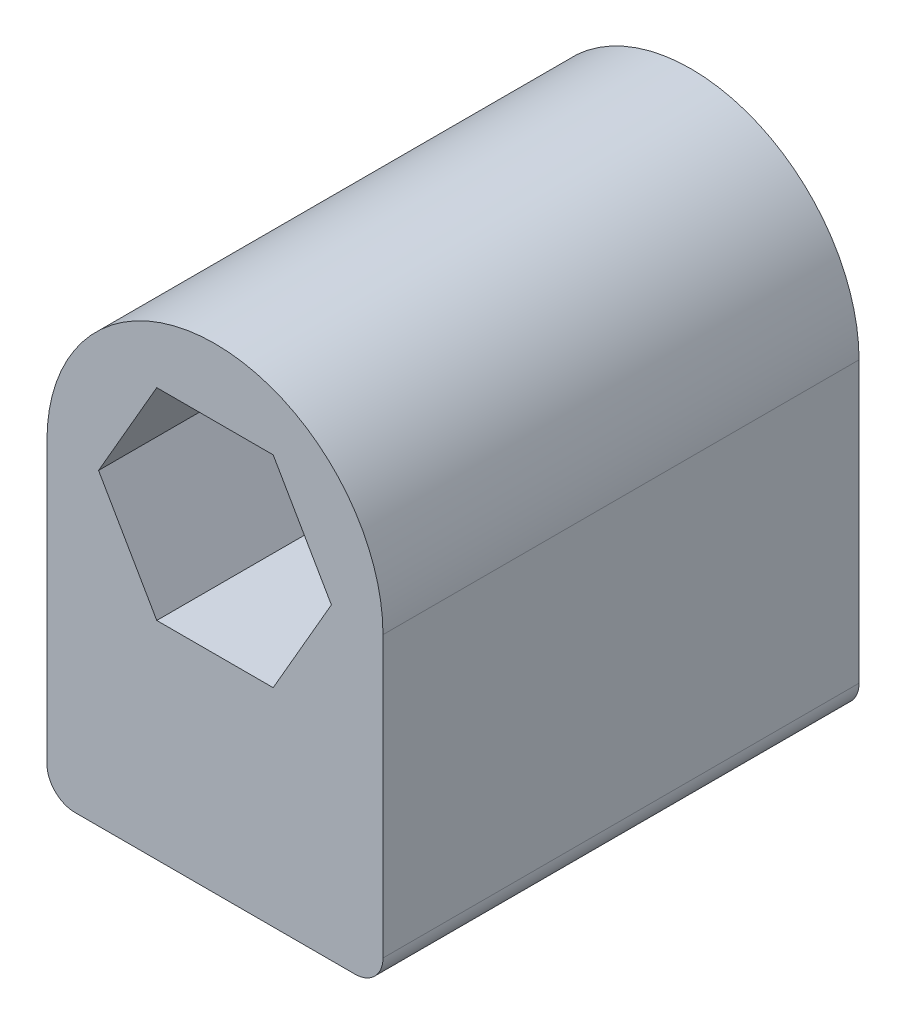
from build123d import *

# Parameters (mm, degrees)
BOSS_EXTRUDE1_DEPTH = 17


with BuildPart() as part:
    # Sketch1 → Boss-Extrude1 (new body)
    with BuildSketch(Plane.XY):
        with BuildLine():
            Line((1, 0), (11, 0))
            ThreePointArc((11, 0), (11.707106781, 0.292893219), (12, 1))
            Line((12, 1), (12, 11))
            ThreePointArc((12, 11), (6, 17), (0, 11))
            Line((0, 11), (0, 1))
            ThreePointArc((0, 1), (0.292893219, 0.292893219), (1, 0))
        make_face()
        Polygon((10.156921938, 11), (8.078460969, 14.6), (3.921539031, 14.6), (1.843078062, 11), (3.921539031, 7.4), (8.078460969, 7.4), align=None, mode=Mode.SUBTRACT)
    extrude(amount=BOSS_EXTRUDE1_DEPTH)


solid = part.part
